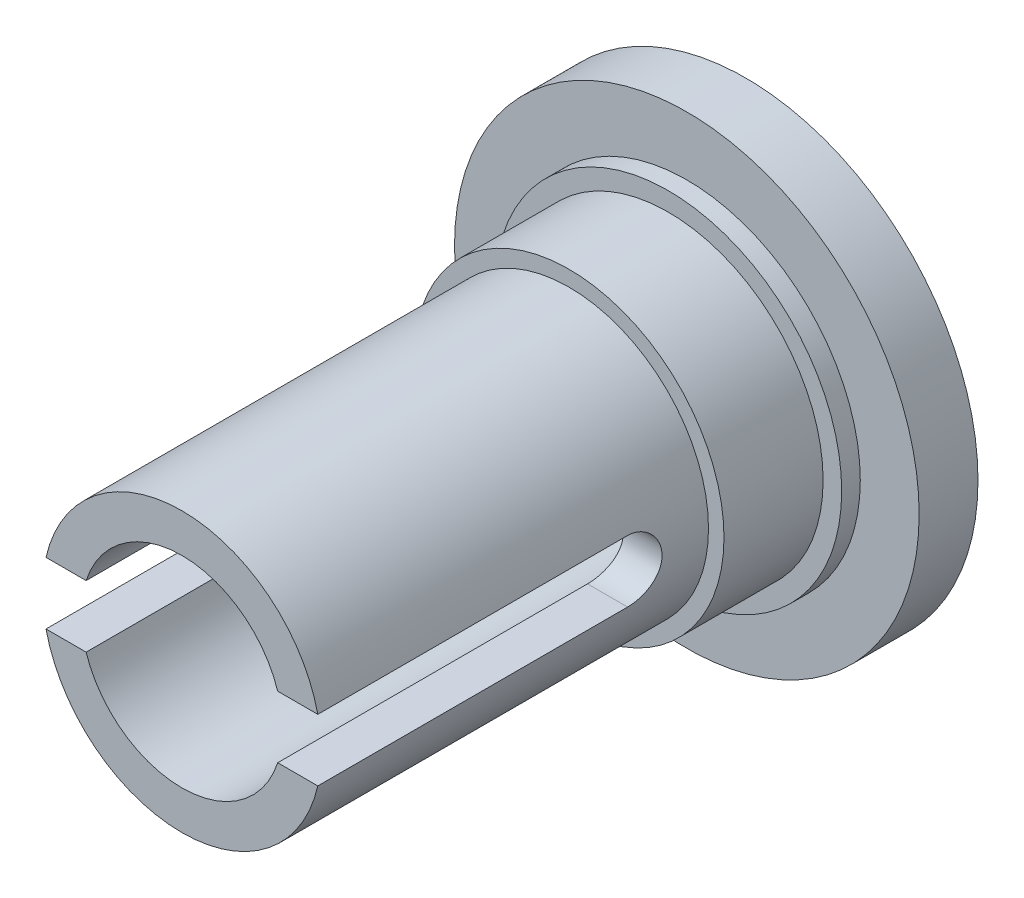
from build123d import *

# Parameters (mm, degrees)
SKETCH1_R           = 9.525
BOSS_EXTRUDE1_DEPTH = 3.175
SKETCH2_R           = 6.35
BOSS_EXTRUDE2_DEPTH = 4.064
SKETCH3_R           = 5.715
BOSS_EXTRUDE3_DEPTH = 15.875
SKETCH4_R           = 4.1275
CUT_EXTRUDE1_DEPTH  = 27.752724086
SKETCH5_W           = 12.7
SKETCH5_H           = 2.54
CUT_EXTRUDE2_DEPTH  = 9.525
CUT_EXTRUDE4_START  = -0.762
SKETCH7_R           = 9.525
SKETCH7_R_2         = 7.112
CUT_EXTRUDE4_DEPTH  = 0.762


with BuildPart() as part:
    # Sketch1 → Boss-Extrude1 (new body)
    with BuildSketch(Plane.XY):
        Circle(SKETCH1_R)
    extrude(amount=BOSS_EXTRUDE1_DEPTH)

    # Sketch2 → Boss-Extrude2 (add)
    with BuildSketch(Plane.XY.offset(3.175)):
        Circle(SKETCH2_R)
    extrude(amount=BOSS_EXTRUDE2_DEPTH)

    # Sketch3 → Boss-Extrude3 (add)
    with BuildSketch(Plane.XY.offset(7.239)):
        Circle(SKETCH3_R)
    extrude(amount=BOSS_EXTRUDE3_DEPTH)

    # Sketch4 → Cut-Extrude1 (cut, through all)
    with BuildSketch(Plane.XY.offset(23.114)):
        Circle(SKETCH4_R)
    extrude(amount=-CUT_EXTRUDE1_DEPTH, mode=Mode.SUBTRACT)

    # Sketch5 → Cut-Extrude2 (cut, symmetric)
    with BuildSketch(Plane(origin=(0, 0, 0), x_dir=(0, 0, -1), z_dir=(1, 0, 0))):
        with Locations((-16.764, 0)):
            Rectangle(SKETCH5_W, SKETCH5_H)
        with BuildLine():
            ThreePointArc((-10.414, 1.27), (-9.144, 0), (-10.414, -1.27))
            Line((-10.414, -1.27), (-10.414, 1.27))
        make_face()
    extrude(amount=CUT_EXTRUDE2_DEPTH, both=True, mode=Mode.SUBTRACT)

    # Sketch7 → Cut-Extrude4 (cut)
    with BuildSketch(Plane.XY.offset(3.175).offset(CUT_EXTRUDE4_START)):
        Circle(SKETCH7_R)
        Circle(SKETCH7_R_2, mode=Mode.SUBTRACT)
    extrude(amount=CUT_EXTRUDE4_DEPTH, mode=Mode.SUBTRACT)


solid = part.part
